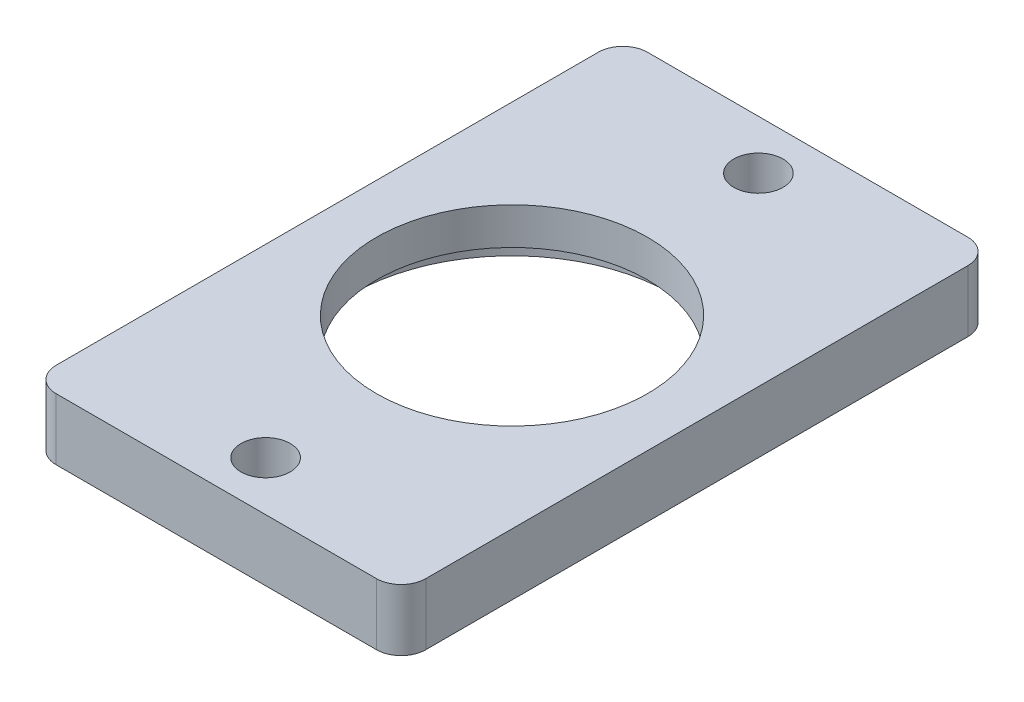
from build123d import *

# Parameters (mm, degrees)
SKETCH_1_R          = 2
SKETCH_1_R_2        = 11
EXTRUDE_1_DEPTH     = 5
SKETCH_1_4_R        = 13
SKETCH_1_4_R_2      = 11
CUT_EXTRUDE_1_DEPTH = 2


with BuildPart() as part:
    # 草图1 → 凸台-拉伸1 (new body)
    with BuildSketch(Plane(origin=(0, 0, 0), x_dir=(1, 0, 0), z_dir=(0, 1, 0))):
        with BuildLine():
            Line((-15, 22), (-15, -22))
            ThreePointArc((-15, -22), (-14.414213562, -23.414213562), (-13, -24))
            Line((-13, -24), (13, -24))
            ThreePointArc((13, -24), (14.414213562, -23.414213562), (15, -22))
            Line((15, -22), (15, 22))
            ThreePointArc((15, 22), (14.414213562, 23.414213562), (13, 24))
            Line((13, 24), (-13, 24))
            ThreePointArc((-13, 24), (-14.414213562, 23.414213562), (-15, 22))
        make_face()
        with Locations((0, -20)):
            Circle(SKETCH_1_R, mode=Mode.SUBTRACT)
        with Locations((0, 20)):
            Circle(SKETCH_1_R, mode=Mode.SUBTRACT)
        Circle(SKETCH_1_R_2, mode=Mode.SUBTRACT)
    extrude(amount=EXTRUDE_1_DEPTH)

    # 草图1<4> → 切除-拉伸1 (cut)
    with BuildSketch(Plane(origin=(0, 0, 0), x_dir=(1, 0, 0), z_dir=(0, 1, 0))):
        Circle(SKETCH_1_4_R)
        Circle(SKETCH_1_4_R_2, mode=Mode.SUBTRACT)
    extrude(amount=CUT_EXTRUDE_1_DEPTH, mode=Mode.SUBTRACT)


solid = part.part
